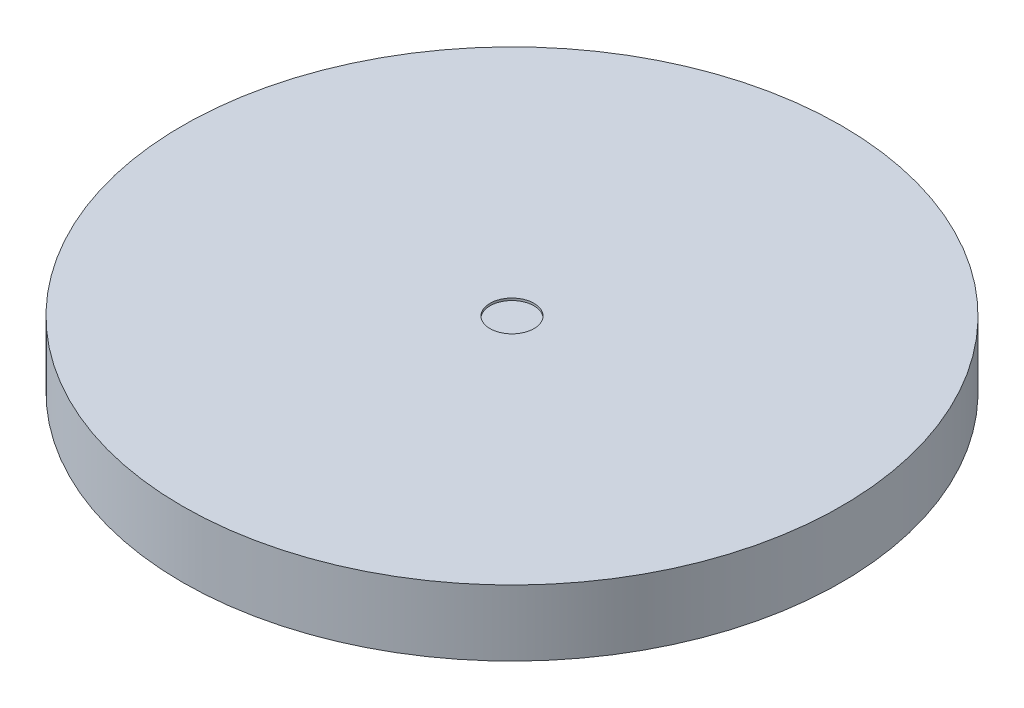
from build123d import *

# Parameters (mm, degrees)
SKETCH1_R           = 30
BOSS_EXTRUDE1_DEPTH = 6
SKETCH2_R           = 2
CUT_EXTRUDE1_DEPTH  = 0.2


with BuildPart() as part:
    # Sketch1 → Boss-Extrude1 (new body)
    with BuildSketch(Plane(origin=(0, 0, 0), x_dir=(1, 0, 0), z_dir=(0, 1, 0))):
        with Locations(Location((0, 0, 0), (0, 0, 270))):
            Circle(SKETCH1_R)
    extrude(amount=BOSS_EXTRUDE1_DEPTH)

    # Sketch2 → Cut-Extrude1 (cut)
    with BuildSketch(Plane(origin=(0, 6, 0), x_dir=(1, 0, 0), z_dir=(0, 1, 0))):
        with Locations(Location((0, 0, 0), (0, 0, 270))):
            Circle(SKETCH2_R)
    extrude(amount=-CUT_EXTRUDE1_DEPTH, mode=Mode.SUBTRACT)


solid = part.part
